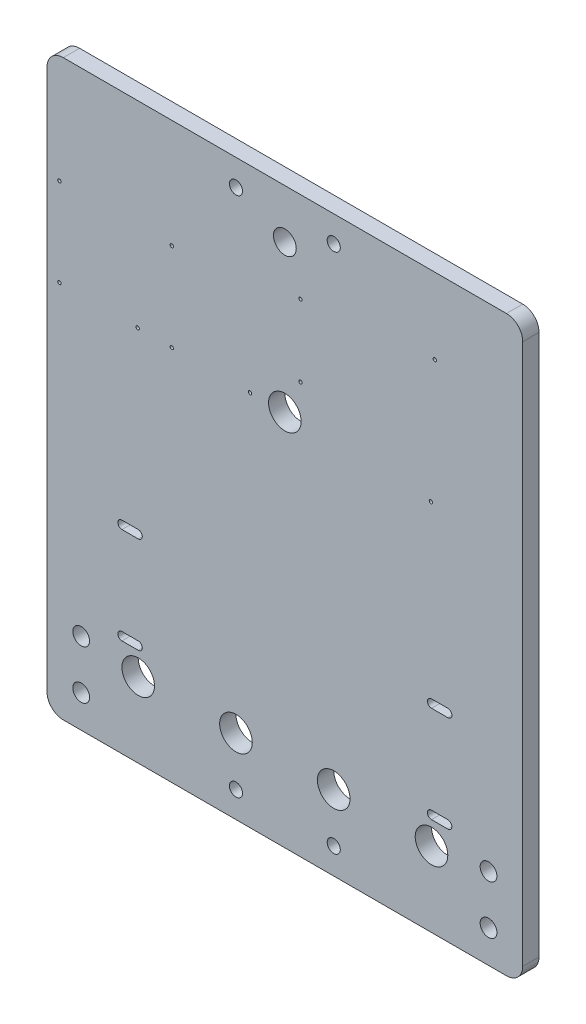
from build123d import *

# Parameters (mm, degrees)
SKETCH2_W                       = 185.42
SKETCH2_H                       = 223.52
SKETCH2_R                       = 2.5527
BOSS_EXTRUDE1_DEPTH             = 6.35
FILLET2_R                       = 6.35
SKETCH5_R                       = 4.445
CUT_EXTRUDE3_DEPTH              = 146.347047442
SKETCH6_R                       = 3.2639
CUT_EXTRUDE6_DEPTH              = 146.347047442
SKETCH8_R                       = 6.35
CUT_EXTRUDE7_DEPTH              = 146.347047442
F_55_0_052_DIAMETER_HOLE1_D     = 1.3208
F_55_0_052_DIAMETER_HOLE2_D     = 1.3208
F_55_0_052_DIAMETER_HOLE2_DEPTH = 25.4
F_55_0_052_DIAMETER_HOLE2_TIP   = 0.396808353


with BuildPart() as part:
    # Sketch2 → Boss-Extrude1 (new body)
    with BuildSketch(Plane.XY.offset(6.35)):
        Rectangle(SKETCH2_W, SKETCH2_H)
        with Locations((-19.05, 101.6)):
            Circle(SKETCH2_R, mode=Mode.SUBTRACT)
        with Locations((19.05, 101.6)):
            Circle(SKETCH2_R, mode=Mode.SUBTRACT)
        with Locations((-19.05, -101.6)):
            Circle(SKETCH2_R, mode=Mode.SUBTRACT)
        with Locations((19.05, -101.6)):
            Circle(SKETCH2_R, mode=Mode.SUBTRACT)
    extrude(amount=BOSS_EXTRUDE1_DEPTH)

    # Fillet2
    fillet2_edges = [part.edges().sort_by_distance(p)[0] for p in [
        (-92.71, 111.76, 9.525),
        (92.71, 111.76, 9.525),
        (92.71, -111.76, 9.525),
        (-92.71, -111.76, 9.525),
    ]]
    fillet(fillet2_edges, radius=FILLET2_R)

    # Sketch5 → Cut-Extrude3 (cut, through all)
    with BuildSketch(Plane.XY.offset(12.7)):
        with Locations((0, 92.71)):
            Circle(SKETCH5_R)
    extrude(amount=-CUT_EXTRUDE3_DEPTH, mode=Mode.SUBTRACT)

    # Sketch6 → Cut-Extrude6 (cut, through all)
    with BuildSketch(Plane(origin=(0, 0, 6.35), x_dir=(-1, 0, 0), z_dir=(0, 0, -1))):
        with Locations((-79.375, -80.01)):
            Circle(SKETCH6_R)
        with Locations(Location((79.375, -80.01, 0), (0, 0, 180))):
            Circle(SKETCH6_R)
        with Locations((-79.375, -99.06)):
            Circle(SKETCH6_R)
        with Locations(Location((79.375, -99.06, 0), (0, 0, 180))):
            Circle(SKETCH6_R)
    extrude(amount=-CUT_EXTRUDE6_DEPTH, mode=Mode.SUBTRACT)

    # Sketch8 → Cut-Extrude7 (cut, through all)
    with BuildSketch(Plane.XY.offset(12.7)):
        with Locations((0, 35.306)):
            Circle(SKETCH8_R)
        with Locations((57.15, -82.55)):
            Circle(SKETCH8_R)
        with Locations((19.05, -82.55)):
            Circle(SKETCH8_R)
        with Locations((-19.05, -82.55)):
            Circle(SKETCH8_R)
        with Locations((-57.15, -82.55)):
            Circle(SKETCH8_R)
        with BuildLine():
            Line((63.5, -36.068), (57.15, -36.068))
            ThreePointArc((57.15, -36.068), (55.5625, -34.4805), (57.15, -32.893))
            Line((57.15, -32.893), (63.5, -32.893))
            ThreePointArc((63.5, -32.893), (65.0875, -34.4805), (63.5, -36.068))
        make_face()
        with BuildLine():
            Line((-57.15, -36.068), (-63.5, -36.068))
            ThreePointArc((-63.5, -36.068), (-65.0875, -34.4805), (-63.5, -32.893))
            Line((-63.5, -32.893), (-57.15, -32.893))
            ThreePointArc((-57.15, -32.893), (-55.5625, -34.4805), (-57.15, -36.068))
        make_face()
        with BuildLine():
            Line((-57.15, -73.66), (-63.5, -73.66))
            ThreePointArc((-63.5, -73.66), (-65.0875, -72.0725), (-63.5, -70.485))
            Line((-63.5, -70.485), (-57.15, -70.485))
            ThreePointArc((-57.15, -70.485), (-55.5625, -72.0725), (-57.15, -73.66))
        make_face()
        with BuildLine():
            Line((57.15, -70.485), (63.5, -70.485))
            ThreePointArc((63.5, -70.485), (65.0875, -72.0725), (63.5, -73.66))
            Line((63.5, -73.66), (57.15, -73.66))
            ThreePointArc((57.15, -73.66), (55.5625, -72.0725), (57.15, -70.485))
        make_face()
    extrude(amount=-CUT_EXTRUDE7_DEPTH, mode=Mode.SUBTRACT)

    # #55 (0.052) Diameter Hole1 (through all)
    with Locations(Plane.XY.offset(12.7)):
        with Locations((-13.5636, 35.069031778), (-44.0436, 35.069031778), (-57.3786, 35.069031778), (-44.0436, 69.409831778), (-87.8586, 35.069031778), (-87.8586, 69.409831778)):
            Hole(F_55_0_052_DIAMETER_HOLE1_D / 2)

    # #55 (0.052) Diameter Hole2
    with Locations(Plane.XY.offset(12.7)):
        with Locations((6.08, 48.508231778), (6.08, 76.508231778), (58.43, 82.208231778), (56.93, 33.508231778)):
            Hole(F_55_0_052_DIAMETER_HOLE2_D / 2, depth=F_55_0_052_DIAMETER_HOLE2_DEPTH)
            with Locations((0, 0, -(F_55_0_052_DIAMETER_HOLE2_DEPTH + F_55_0_052_DIAMETER_HOLE2_TIP / 2))):  # 118° drill point
                Cone(0, F_55_0_052_DIAMETER_HOLE2_D / 2, F_55_0_052_DIAMETER_HOLE2_TIP, mode=Mode.SUBTRACT)


solid = part.part
